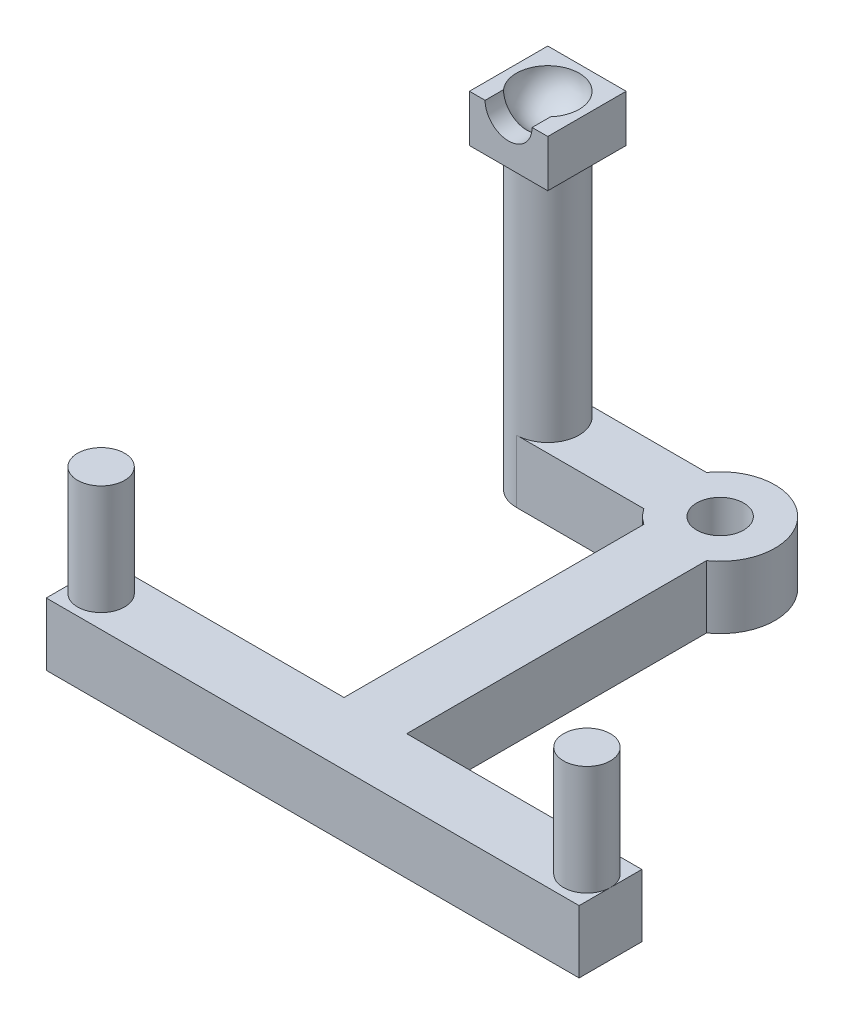
from build123d import *

# Parameters (mm, degrees)
SKETCH1_R            = 7.5
BOSS_EXTRUDE9_DEPTH  = 20
SKETCH3_R            = 7.5
BOSS_EXTRUDE10_DEPTH = 35
SKETCH5_W            = 20
SKETCH5_H            = 20
BOSS_EXTRUDE11_DEPTH = 55
CUT_EXTRUDE2_DEPTH   = 228.774559598
BOSS_EXTRUDE13_START = 75
SKETCH10_R           = 10
BOSS_EXTRUDE13_DEPTH = 75
SKETCH12_W           = 25
SKETCH12_H           = 25
BOSS_EXTRUDE14_DEPTH = 15
SKETCH21_R           = 7.5
CUT_EXTRUDE8_DEPTH   = 8


with BuildPart() as part:
    # Sketch1 → Boss-Extrude9 (new body)
    with BuildSketch(Plane(origin=(0, 0, 0), x_dir=(1, 0, 0), z_dir=(0, 1, 0))):
        with BuildLine():
            Line((0, 0), (170, 0))
            Line((170, 0), (170, 20))
            Line((170, 20), (95, 20))
            Line((95, 20), (95, 115.638593384))
            ThreePointArc((95, 115.638593384), (85, 147.5), (75, 115.638593384))
            Line((75, 115.638593384), (75, 20))
            Line((75, 20), (0, 20))
            Line((0, 20), (0, 0))
        make_face()
        with Locations(Location((85, 130, 0), (0, 0, 270))):
            Circle(SKETCH1_R, mode=Mode.SUBTRACT)
    extrude(amount=-BOSS_EXTRUDE9_DEPTH)

    # Sketch3 → Boss-Extrude10 (add)
    with BuildSketch(Plane(origin=(0, 0, 0), x_dir=(1, 0, 0), z_dir=(0, 1, 0))):
        with Locations(Location((7.5, 10, 0), (0, 0, 180))):
            Circle(SKETCH3_R)
        with Locations((162.5, 10)):
            Circle(SKETCH3_R)
    extrude(amount=BOSS_EXTRUDE10_DEPTH)

    # Sketch5 → Boss-Extrude11 (add)
    with BuildSketch(Plane.ZY.offset(-75)):
        with Locations((-130, -10)):
            Rectangle(SKETCH5_W, SKETCH5_H)
    extrude(amount=BOSS_EXTRUDE11_DEPTH)

    # Sketch6 → Cut-Extrude2 (cut, through all)
    with BuildSketch(Plane(origin=(0, 0, 0), x_dir=(1, 0, 0), z_dir=(0, 1, 0))):
        with BuildLine():
            Line((20, 130), (20, 120))
            Line((20, 120), (30, 120))
            ThreePointArc((30, 120), (22.928932188, 122.928932188), (20, 130))
        make_face()
        with BuildLine():
            Line((20, 140), (20, 130))
            ThreePointArc((20, 130), (22.928932188, 137.071067812), (30, 140))
            Line((30, 140), (20, 140))
        make_face()
    extrude(amount=-CUT_EXTRUDE2_DEPTH, mode=Mode.SUBTRACT)

    # Sketch10 → Boss-Extrude13 (add)
    with BuildSketch(Plane(origin=(0, 0, 0), x_dir=(1, 0, 0), z_dir=(0, 1, 0)).offset(BOSS_EXTRUDE13_START)):
        with Locations(Location((30, 130, 0), (0, 0, 270))):
            Circle(SKETCH10_R)
    extrude(amount=-BOSS_EXTRUDE13_DEPTH)

    # Sketch12 → Boss-Extrude14 (add)
    with BuildSketch(Plane(origin=(0, 75, 0), x_dir=(1, 0, 0), z_dir=(0, 1, 0))):
        with Locations((30, 130)):
            Rectangle(SKETCH12_W, SKETCH12_H)
    extrude(amount=BOSS_EXTRUDE14_DEPTH)

    # Sketch20 → Cut-Revolve5 (revolve, cut)
    with BuildSketch(Plane(origin=(0, 90, 0), x_dir=(1, 0, 0), z_dir=(0, 1, 0))):
        with BuildLine():
            Line((30, 140), (30, 120))
            ThreePointArc((30, 120), (40, 130), (30, 140))
        make_face()
    revolve(axis=Axis((30, 90, -140), (0, 0, 1)), mode=Mode.SUBTRACT)

    # Sketch21 → Cut-Extrude8 (cut)
    with BuildSketch(Plane.XY.offset(-117.5)):
        with Locations((30, 90)):
            Circle(SKETCH21_R)
    extrude(amount=-CUT_EXTRUDE8_DEPTH, mode=Mode.SUBTRACT)


solid = part.part
